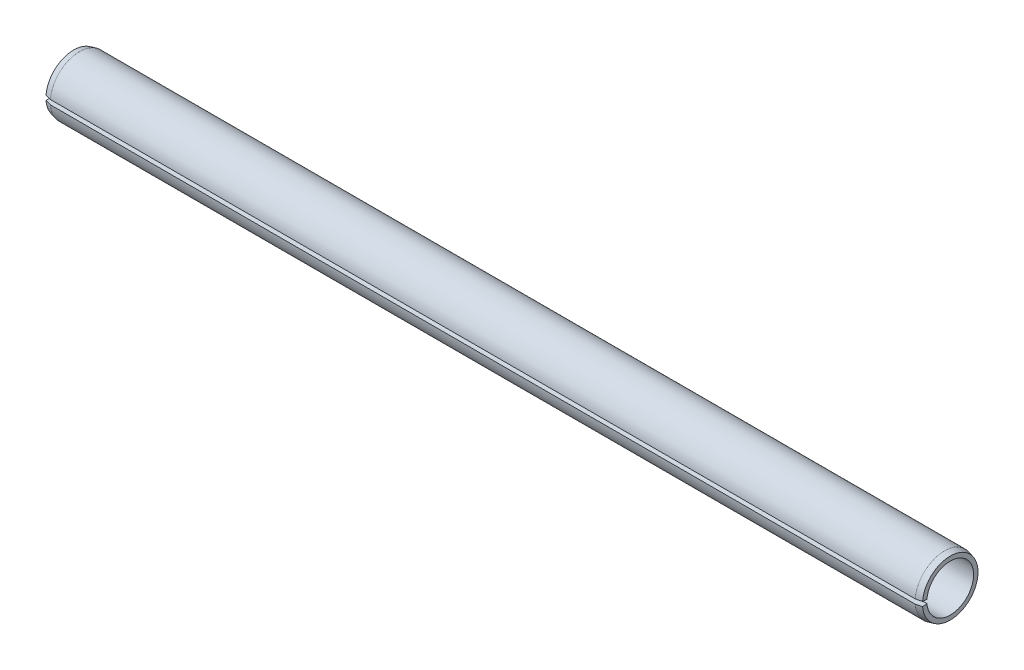
from build123d import *

# Parameters (mm, degrees)
GAP_DEPTH = 31.033314835


with BuildPart() as part:
    # Sketch1 → Base-Revolve (revolve)
    with BuildSketch(Plane.XY, mode=Mode.PRIVATE) as base_revolve_sk:
        Polygon((0, 0.8), (30, 0.8), (30, 0.95), (29.8, 1), (0.2, 1), (0, 0.95), align=None)
    revolve(base_revolve_sk.sketch.rotate(Axis((-9.525, 0, 0), (1, 0, 0)), 90), axis=Axis((-9.525, 0, 0), (1, 0, 0)))

    # Sketch2 → Gap (cut, through all)
    with BuildSketch(Plane(origin=(0, 0, 0), x_dir=(0, -1, 0), z_dir=(-1, 0, 0))):
        with BuildLine():
            Line((0, 0), (0.080028278, 1.01685568))
            ThreePointArc((0.080028278, 1.01685568), (0, 1.02), (-0.080028278, 1.01685568))
            Line((-0.080028278, 1.01685568), (0, 0))
        make_face()
    extrude(amount=-GAP_DEPTH, mode=Mode.SUBTRACT)


solid = part.part
